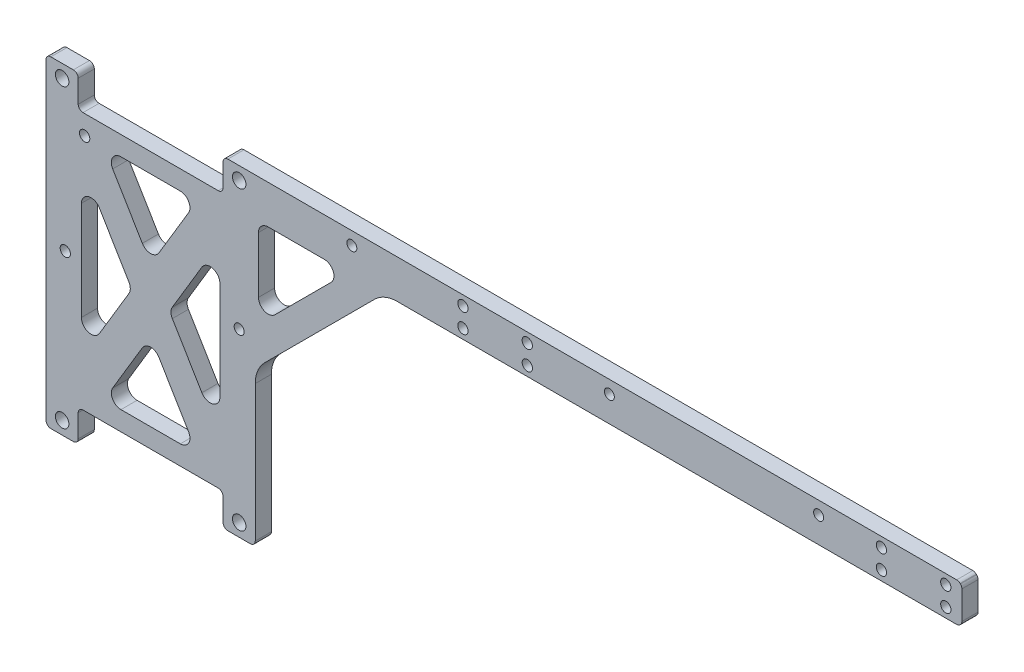
from build123d import *

# Parameters (mm, degrees)
SKETCH_1_W          = 160
SKETCH_1_H          = 12
SKETCH_1_R          = 1.6
EXTRUDE_1_DEPTH     = 5
CHAMFER_1_SIZE      = 1
SKETCH_2_W          = 124.5
SKETCH_2_H          = 12
SKETCH_2_W_2        = 65
SKETCH_2_H_2        = 88
EXTRUDE_2_DEPTH     = 5
CHAMFER_2_SIZE      = 40
SKETCH_3_R          = 2.1
SKETCH_3_W          = 45
SKETCH_3_H          = 20
CUT_EXTRUDE_1_DEPTH = 226.124965297
CUT_EXTRUDE_2_DEPTH = 226.124965297
CUT_EXTRUDE_3_DEPTH = 226.124965297
FILLET_1_R          = 3
FILLET_2_R          = 1.5
SKETCH_6_R          = 1.55
CUT_EXTRUDE_4_DEPTH = 226.124965297
FILLET_3_R          = 10
SKETCH_7_R          = 1.6
CUT_EXTRUDE_5_DEPTH = 226.124965297


with BuildPart() as part:
    # 草图1 → 凸台-拉伸1 (new body)
    with BuildSketch(Plane.XY):
        Rectangle(SKETCH_1_W, SKETCH_1_H)
        with Locations((55, -3)):
            Circle(SKETCH_1_R, mode=Mode.SUBTRACT)
        with Locations((75, -3)):
            Circle(SKETCH_1_R, mode=Mode.SUBTRACT)
        with Locations((-75, -3)):
            Circle(SKETCH_1_R, mode=Mode.SUBTRACT)
        with Locations((-55, -3)):
            Circle(SKETCH_1_R, mode=Mode.SUBTRACT)
        with Locations(Location((-75, 3, 0), (0, 0, 180))):
            Circle(SKETCH_1_R, mode=Mode.SUBTRACT)
        with Locations(Location((-55, 3, 0), (0, 0, 180))):
            Circle(SKETCH_1_R, mode=Mode.SUBTRACT)
        with Locations(Location((55, 3, 0), (0, 0, 180))):
            Circle(SKETCH_1_R, mode=Mode.SUBTRACT)
        with Locations(Location((75, 3, 0), (0, 0, 180))):
            Circle(SKETCH_1_R, mode=Mode.SUBTRACT)
    extrude(amount=EXTRUDE_1_DEPTH)

    # 倒角1
    chamfer_1_edges = [part.edges().sort_by_distance(p)[0] for p in [
        (80, -6, 2.5),
        (80, 6, 2.5),
    ]]
    chamfer(chamfer_1_edges, length=CHAMFER_1_SIZE)


with BuildPart() as body_2:
    # 草图2 → 凸台-拉伸2 (new body)
    with BuildSketch(Plane(origin=(0, 0, 0), x_dir=(-1, 0, 0), z_dir=(0, 0, -1))):
        with Locations((142.25, 0)):
            Rectangle(SKETCH_2_W, SKETCH_2_H)
        with Locations((172, -50)):
            Rectangle(SKETCH_2_W_2, SKETCH_2_H_2)
    extrude(amount=-EXTRUDE_2_DEPTH)

    # Combine 1: union part
    add(part.part)

    # 倒角2
    chamfer_2_edges = [body_2.edges().sort_by_distance(p)[0] for p in [
        (-139.5, -6, 2.5),
    ]]
    chamfer(chamfer_2_edges, length=CHAMFER_2_SIZE)

    # 草图3 → 切除-拉伸1 (cut, through all)
    with BuildSketch(Plane(origin=(0, 0, 0), x_dir=(-1, 0, 0), z_dir=(0, 0, -1))):
        with Locations((144.5, -90)):
            Circle(SKETCH_3_R)
        with Locations((199.5, -90)):
            Circle(SKETCH_3_R)
        with Locations((144.5, 2)):
            Circle(SKETCH_3_R)
        with Locations((199.5, 2)):
            Circle(SKETCH_3_R)
        with Locations((172, -94)):
            Rectangle(SKETCH_3_W, SKETCH_3_H)
        with Locations((172, 6)):
            Rectangle(SKETCH_3_W, SKETCH_3_H)
    extrude(amount=-CUT_EXTRUDE_1_DEPTH, mode=Mode.SUBTRACT)

    # 草图4 → 切除-拉伸2 (cut, through all)
    with BuildSketch(Plane.XY.offset(5)):
        Polygon((-150.5, -17.780613901), (-166.174632994, -44), (-150.5, -70.219386099), align=None)
        Polygon((-186.50071995, -10), (-172, -34.255749735), (-157.49928005, -10), align=None)
        Polygon((-172, -53.744250265), (-186.50071995, -78), (-157.49928005, -78), align=None)
        Polygon((-193.5, -17.780613901), (-193.5, -70.219386099), (-177.825367006, -44), align=None)
    extrude(amount=-CUT_EXTRUDE_2_DEPTH, mode=Mode.SUBTRACT)

    # 草图5 → 切除-拉伸3 (cut, through all)
    with BuildSketch(Plane(origin=(0, 0, 0), x_dir=(-1, 0, 0), z_dir=(0, 0, -1))):
        Polygon((110.813708499, -6), (138.5, -33.686291501), (138.5, -6), align=None)
    extrude(amount=-CUT_EXTRUDE_3_DEPTH, mode=Mode.SUBTRACT)

    # 圆角1
    fillet_1_edges = [body_2.edges().sort_by_distance(p)[0] for p in [
        (-157.49928005, -10, 2.5),
        (-172, -34.255749735, 2.5),
        (-186.50071995, -10, 2.5),
        (-186.50071995, -78, 2.5),
        (-172, -53.744250265, 2.5),
        (-157.49928005, -78, 2.5),
        (-193.5, -17.780613901, 2.5),
        (-177.825367006, -44, 2.5),
        (-193.5, -70.219386099, 2.5),
        (-150.5, -17.780613901, 2.5),
        (-150.5, -70.219386099, 2.5),
        (-166.174632994, -44, 2.5),
        (-110.813708499, -6, 2.5),
        (-138.5, -6, 2.5),
        (-138.5, -33.686291501, 2.5),
    ]]
    fillet(fillet_1_edges, radius=FILLET_1_R)

    # 圆角2
    fillet_2_edges = [body_2.edges().sort_by_distance(p)[0] for p in [
        (-204.5, -94, 2.5),
        (-139.5, -94, 2.5),
        (80, -5, 2.5),
        (80, 5, 2.5),
        (79, 6, 2.5),
        (79, -6, 2.5),
        (-204.5, 6, 2.5),
        (-194.5, -94, 2.5),
        (-149.5, -94, 2.5),
        (-194.5, -84, 2.5),
        (-149.5, -84, 2.5),
        (-194.5, 6, 2.5),
        (-149.5, 6, 2.5),
        (-149.5, -4, 2.5),
        (-194.5, -4, 2.5),
    ]]
    fillet(fillet_2_edges, radius=FILLET_2_R)

    # 草图6 → 切除-拉伸4 (cut, through all)
    with BuildSketch(Plane(origin=(0, 0, 0), x_dir=(-1, 0, 0), z_dir=(0, 0, -1))):
        with Locations((109.5, 2)):
            Circle(SKETCH_6_R)
        with Locations((144.5, -38)):
            Circle(SKETCH_6_R)
        with Locations((29.5, 2)):
            Circle(SKETCH_6_R)
        with Locations((-35.5, 2)):
            Circle(SKETCH_6_R)
    extrude(amount=-CUT_EXTRUDE_4_DEPTH, mode=Mode.SUBTRACT)

    # 圆角3
    fillet_3_edges = [body_2.edges().sort_by_distance(p)[0] for p in [
        (-99.5, -6, 2.5),
        (-139.5, -46, 2.5),
    ]]
    fillet(fillet_3_edges, radius=FILLET_3_R)

    # 草图7 → 切除-拉伸5 (cut, through all)
    with BuildSketch(Plane.XY.offset(5)):
        with Locations((-192.5, -10)):
            Circle(SKETCH_7_R)
        with Locations((-198.5, -44)):
            Circle(SKETCH_7_R)
    extrude(amount=-CUT_EXTRUDE_5_DEPTH, mode=Mode.SUBTRACT)


solid = body_2.part
